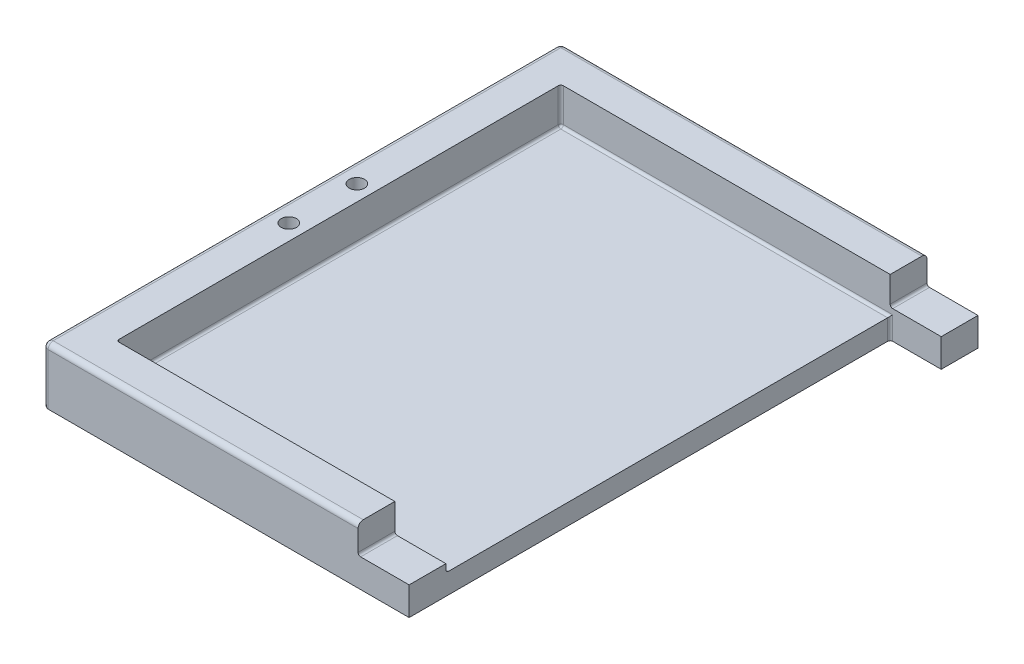
from build123d import *

# Parameters (mm, degrees)
SKETCH1_W           = 71.7
SKETCH1_H           = 101.4
BOSS_EXTRUDE1_DEPTH = 11.1
SKETCH5_W           = 87
SKETCH5_H           = 14.461590439
CUT_EXTRUDE1_DEPTH  = 64.5
FILLET2_R           = 1
SKETCH7_R           = 1.5
CUT_EXTRUDE3_DEPTH  = 4
SKETCH10_W          = 8.724930765
SKETCH10_H          = 5.55
CUT_EXTRUDE5_DEPTH  = 10
SKETCH11_W          = 7.2
SKETCH11_H          = 5.55
BOSS_EXTRUDE2_DEPTH = 10
FILLET3_R           = 0.5


with BuildPart() as part:
    # Sketch1 → Boss-Extrude1 (new body)
    with BuildSketch(Plane(origin=(0, 0, 0), x_dir=(1, 0, 0), z_dir=(0, 1, 0))):
        Rectangle(SKETCH1_W, SKETCH1_H)
    extrude(amount=BOSS_EXTRUDE1_DEPTH)

    # Sketch5 → Cut-Extrude1 (cut)
    with BuildSketch(Plane(origin=(35.85, 0, 0), x_dir=(0, 0, -1), z_dir=(1, 0, 0))):
        with Locations((0, 11.23079522)):
            Rectangle(SKETCH5_W, SKETCH5_H)
    extrude(amount=-CUT_EXTRUDE1_DEPTH, mode=Mode.SUBTRACT)

    # Fillet2
    fillet2_edges = [part.edges().sort_by_distance(p)[0] for p in [
        (0, 11.1, -50.7),
        (-35.85, 11.1, 0),
        (-35.85, 0, 0),
        (0, 11.1, 50.7),
        (-35.85, 5.55, -50.7),
        (-35.85, 5.55, 50.7),
    ]]
    fillet(fillet2_edges, radius=FILLET2_R)

    # Sketch7 → Cut-Extrude3 (cut)
    with BuildSketch(Plane(origin=(0, 11.1, 0), x_dir=(1, 0, 0), z_dir=(0, 1, 0))):
        with Locations(Location((-31.75, -6.65790951, 0), (0, 0, 270))):
            Circle(SKETCH7_R)
        with Locations(Location((-31.75, 6.65790951, 0), (0, 0, 90))):
            Circle(SKETCH7_R)
    extrude(amount=-CUT_EXTRUDE3_DEPTH, mode=Mode.SUBTRACT)

    # Sketch10 → Cut-Extrude5 (cut)
    with BuildSketch(Plane(origin=(35.85, 0, 0), x_dir=(0, 0, -1), z_dir=(1, 0, 0))):
        with Locations((-47.862465383, 8.325)):
            Rectangle(SKETCH10_W, SKETCH10_H)
    extrude(amount=-CUT_EXTRUDE5_DEPTH, mode=Mode.SUBTRACT)

    # Sketch11 → Boss-Extrude2 (add)
    with BuildSketch(Plane(origin=(35.85, 0, 0), x_dir=(0, 0, -1), z_dir=(1, 0, 0))):
        with Locations((47.1, 2.775)):
            Rectangle(SKETCH11_W, SKETCH11_H)
    extrude(amount=BOSS_EXTRUDE2_DEPTH)

    # Fillet3
    fillet3_edges = [part.edges().sort_by_distance(p)[0] for p in [
        (-28.65, 4, 0),
        (3.6, 4, -43.5),
        (3.6, 4, 43.5),
        (-28.65, 7.55, -43.5),
        (-28.65, 7.55, 43.5),
        (25.85, 5.55, 47.1),
        (35.85, 5.55, -47.1),
        (35.85, 2, -43.5),
    ]]
    fillet(fillet3_edges, radius=FILLET3_R)


solid = part.part
